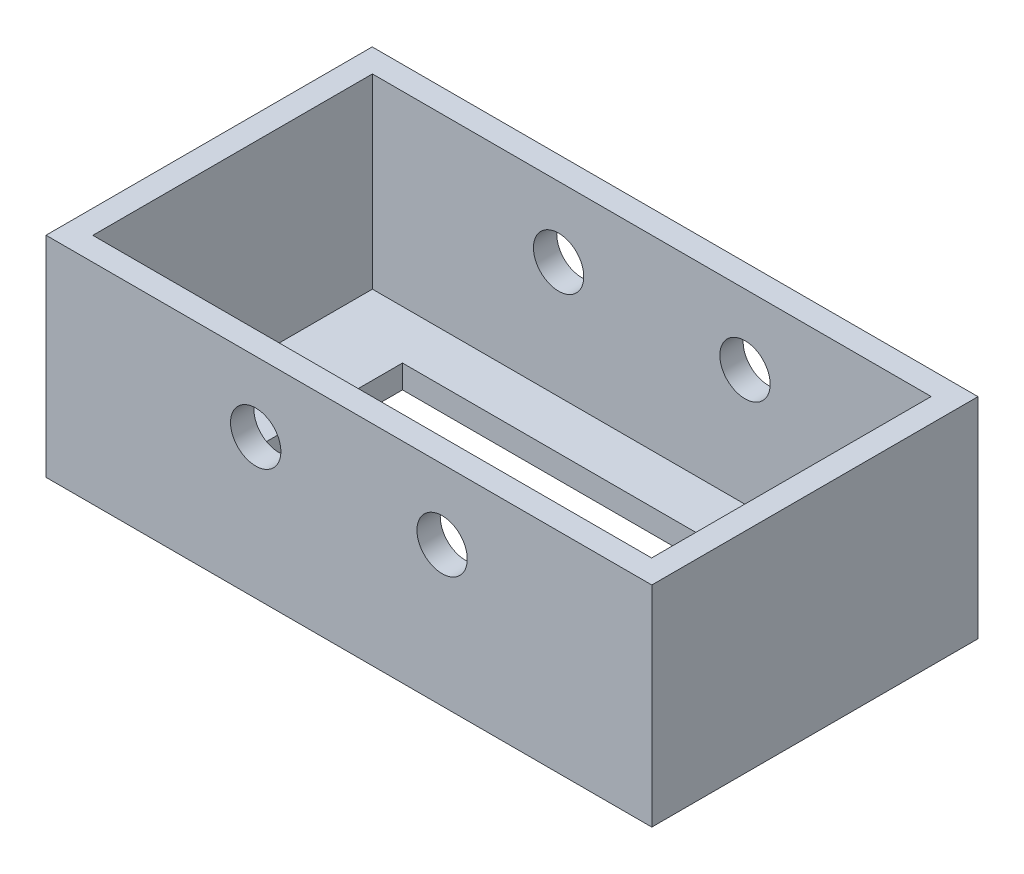
from build123d import *

# Parameters (mm, degrees)
SKETCH1_W           = 82.55
SKETCH1_H           = 44.45
BOSS_EXTRUDE1_DEPTH = 3.175
SKETCH2_R           = 2.54
CUT_EXTRUDE1_DEPTH  = 3.175
SKETCH4_W           = 54.61
SKETCH4_H           = 24.765
CUT_EXTRUDE2_DEPTH  = 3.175
SKETCH5_W           = 82.55
SKETCH5_H           = 3.175
BOSS_EXTRUDE2_DEPTH = 25.4
SKETCH7_W           = 3.204255847
SKETCH7_H           = 38.1
BOSS_EXTRUDE3_DEPTH = 25.4
SKETCH6_R           = 3.429
CUT_EXTRUDE3_DEPTH  = 99.014466407


with BuildPart() as part:
    # Sketch1 → Boss-Extrude1 (new body)
    with BuildSketch(Plane(origin=(0, 0, 0), x_dir=(1, 0, 0), z_dir=(0, 1, 0))):
        with Locations((41.275, 22.225)):
            Rectangle(SKETCH1_W, SKETCH1_H)
    extrude(amount=BOSS_EXTRUDE1_DEPTH)

    # Sketch2 → Cut-Extrude1 (cut)
    with BuildSketch(Plane(origin=(0, 3.175, 0), x_dir=(1, 0, 0), z_dir=(0, 1, 0))):
        with Locations(Location((9.525, 22.225, 0), (0, 0, 270))):
            Circle(SKETCH2_R)
        with Locations(Location((73.025, 22.225, 0), (0, 0, 90))):
            Circle(SKETCH2_R)
    extrude(amount=-CUT_EXTRUDE1_DEPTH, mode=Mode.SUBTRACT)

    # Sketch4 → Cut-Extrude2 (cut)
    with BuildSketch(Plane(origin=(0, 3.175, 0), x_dir=(1, 0, 0), z_dir=(0, 1, 0))):
        with Locations((41.275, 22.225)):
            Rectangle(SKETCH4_W, SKETCH4_H)
    extrude(amount=-CUT_EXTRUDE2_DEPTH, mode=Mode.SUBTRACT)

    # Sketch5 → Boss-Extrude2 (add)
    with BuildSketch(Plane(origin=(0, 3.175, 0), x_dir=(1, 0, 0), z_dir=(0, 1, 0))):
        with Locations((41.275, 42.8625)):
            Rectangle(SKETCH5_W, SKETCH5_H)
        with Locations((41.275, 1.5875)):
            Rectangle(SKETCH5_W, SKETCH5_H)
    extrude(amount=BOSS_EXTRUDE2_DEPTH)

    # Sketch7 → Boss-Extrude3 (add)
    with BuildSketch(Plane(origin=(0, 3.175, 0), x_dir=(1, 0, 0), z_dir=(0, 1, 0))):
        with Locations((1.602127924, 22.225)):
            Rectangle(SKETCH7_W, SKETCH7_H)
        with Locations((80.947872077, 22.225)):
            Rectangle(SKETCH7_W, SKETCH7_H)
    extrude(amount=BOSS_EXTRUDE3_DEPTH)

    # Sketch6 → Cut-Extrude3 (cut, through all)
    with BuildSketch(Plane(origin=(0, 0, -44.45), x_dir=(-1, 0, 0), z_dir=(0, 0, -1))):
        with Locations((-28.575, 19.05)):
            Circle(SKETCH6_R)
        with Locations((-53.975, 19.05)):
            Circle(SKETCH6_R)
    extrude(amount=-CUT_EXTRUDE3_DEPTH, mode=Mode.SUBTRACT)


solid = part.part
